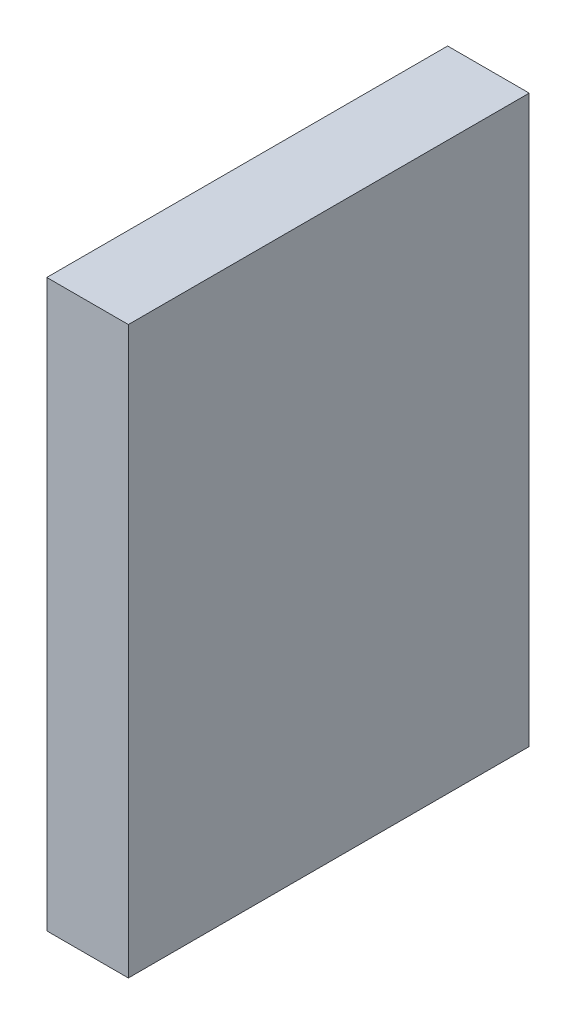
from build123d import *

# Parameters (mm, degrees)
SKETCH1_W           = 215.9
SKETCH1_H           = 304.8
BOSS_EXTRUDE1_DEPTH = 43.942


with BuildPart() as part:
    # Sketch1 → Boss-Extrude1 (new body)
    with BuildSketch(Plane(origin=(0, 0, 0), x_dir=(0, 0, -1), z_dir=(1, 0, 0))):
        with Locations((6.805543478, 33.655)):
            Rectangle(SKETCH1_W, SKETCH1_H)
    extrude(amount=BOSS_EXTRUDE1_DEPTH)


solid = part.part
